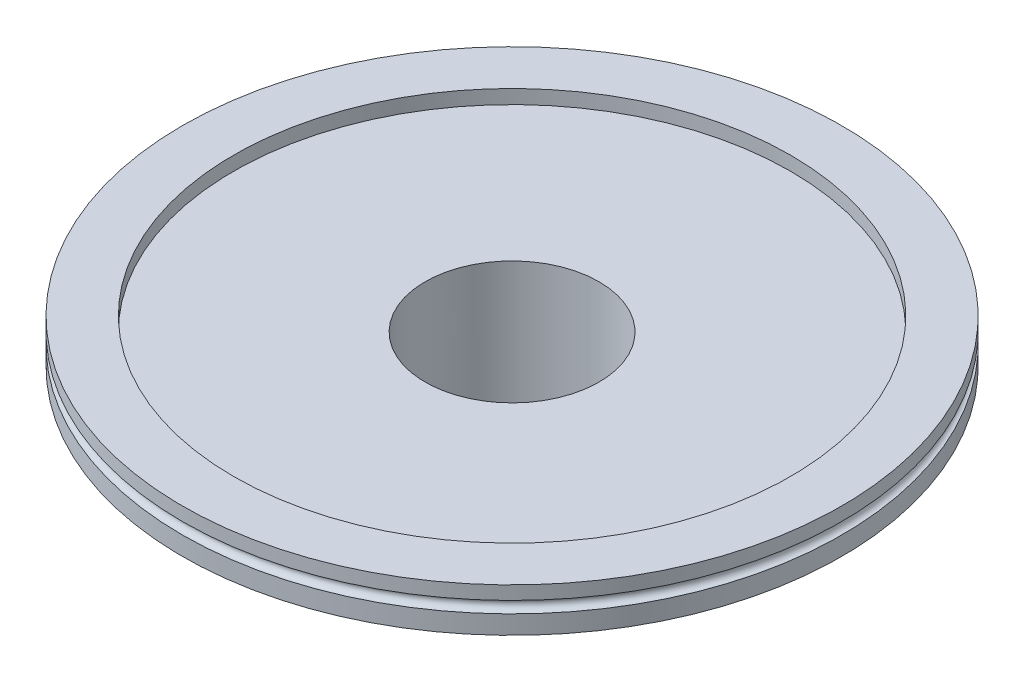
from build123d import *

# Parameters (mm, degrees)
SKETCH1_W  = 89.999999997
SKETCH1_H  = 11.938
SKETCH13_W = 5.08
SKETCH13_H = 2.032


with BuildPart() as part:
    # Sketch1 → Blank (revolve)
    with BuildSketch(Plane.XY):
        with Locations((-44.999999999, 0)):
            Rectangle(SKETCH1_W, SKETCH1_H)
    revolve(axis=Axis((0, 5.969, 0), (0, -1, 0)))

    # Sketch7 → Single Side Bore (revolve, cut)
    with BuildSketch(Plane.XY, mode=Mode.PRIVATE) as single_side_bore_sk:
        Polygon((-23.749, -5.969), (-23.749, 2.159), (-76.029999997, 2.159), (-76.029999997, 5.969), (0, 5.969), (0, -5.969), align=None)
    revolve(single_side_bore_sk.sketch.rotate(Axis((0, 5.969, 0), (0, 1, 0)), 270), axis=Axis((0, 5.969, 0), (0, 1, 0)), mode=Mode.SUBTRACT)



with BuildPart() as body_2:
    # Sketch9 → KF Flange (revolve)
    with BuildSketch(Plane.XY, mode=Mode.PRIVATE) as kf_flange_sk:
        Polygon((30.355443212, -34.925), (23.749, -34.925), (23.749, -37.3888), (26.1239, -37.3888), (26.1239, -40.005), (37.465, -40.005), (37.465, -36.83), align=None)
    revolve(kf_flange_sk.sketch.rotate(Axis((0, 5.969, 0), (0, -1, 0)), 180), axis=Axis((0, 5.969, 0), (0, -1, 0)))


with BuildPart() as part_1:
    add(part.part)

    add(body_2.part)  # Revolve1 merges body 2
    # Sketch8 → Revolve1 (revolve)
    with BuildSketch(Plane.XY, mode=Mode.PRIVATE) as revolve1_sk:
        Polygon((-23.749, 2.159), (-23.749, -13.081), (-23.749, -22.1488), (-23.749, -37.3888), (-25.4, -37.3888), (-25.4, -22.1488), (-25.4, -13.081), (-25.4, 2.159), align=None)
    revolve(revolve1_sk.sketch.rotate(Axis((0, 0, 0), (0, -1, 0)), 180), axis=Axis((0, 0, 0), (0, -1, 0)))

    # Sketch13 → Cut-Revolve2 (revolve, cut)
    with BuildSketch(Plane.XY, mode=Mode.PRIVATE) as cut_revolve2_sk:
        with Locations((-84.919999997, -4.953)):
            Rectangle(SKETCH13_W, SKETCH13_H)
    revolve(cut_revolve2_sk.sketch.rotate(Axis((0, 0, 0), (0, -1, 0)), 270), axis=Axis((0, 0, 0), (0, -1, 0)), mode=Mode.SUBTRACT)

    # Sketch15 → Cut-Revolve3 (revolve, cut)
    with BuildSketch(Plane.XY):
        with BuildLine():
            Line((-89.999999997, 2.286), (-89.999999997, -0.889))
            ThreePointArc((-89.999999997, -0.889), (-88.412499997, 0.6985), (-89.999999997, 2.286))
        make_face()
    revolve(axis=Axis((0, 0, 0), (0, -1, 0)), mode=Mode.SUBTRACT)


solid = part_1.part
